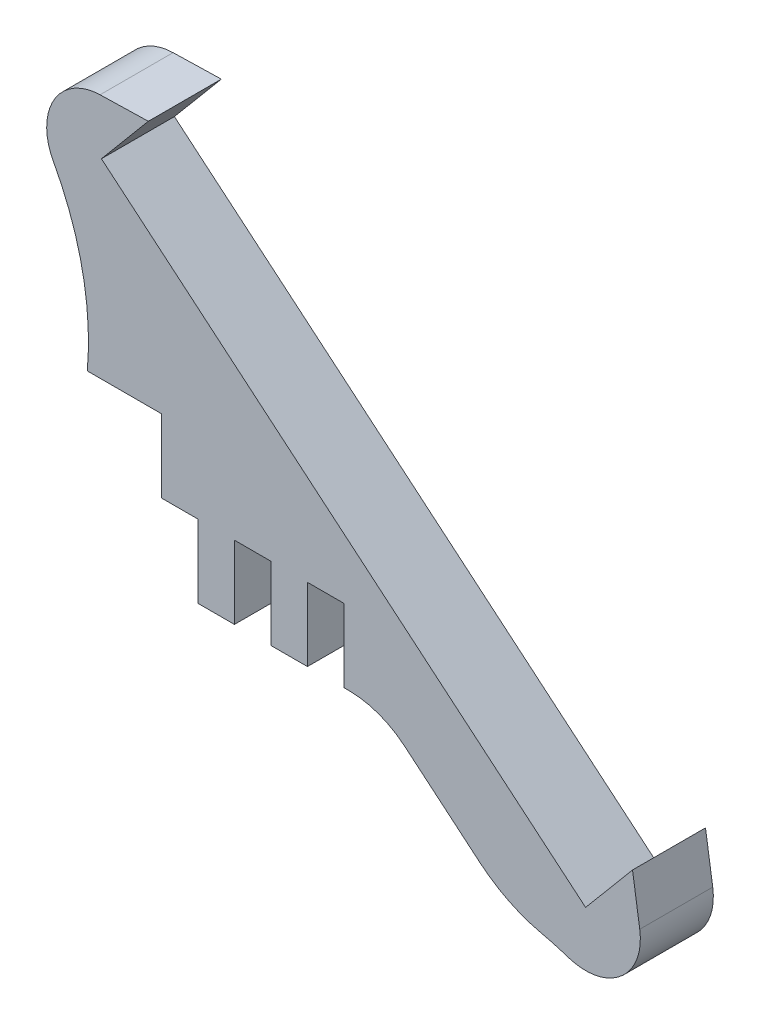
from build123d import *

# Parameters (mm, degrees)
BOSS_EXTRUDE1_DEPTH = 6.35


with BuildPart() as part:
    # Sketch1 → Boss-Extrude1 (new body)
    with BuildSketch(Plane.XY):
        with BuildLine():
            Line((8.142065145, 0), (11.317065145, 0))
            Line((11.317065145, 0), (11.317065145, -6.35))
            Line((11.317065145, -6.35), (14.492065145, -6.35))
            Line((14.492065145, -6.35), (14.492065145, 0))
            Line((14.492065145, 0), (17.667065145, 0))
            Line((17.667065145, 0), (17.667065145, -6.35))
            Line((17.667065145, -6.35), (20.842065145, -6.35))
            Line((20.842065145, -6.35), (20.842065145, 0))
            Line((20.842065145, 0), (24.017065145, 0))
            Line((24.017065145, 0), (24.017065145, -6.35))
            Line((24.017065145, -6.35), (24.41861196, -6.35))
            ThreePointArc((24.41861196, -6.35), (27.024805452, -6.80954223), (29.316653546, -8.132741343))
            Line((29.316653546, -8.132741343), (35.829824373, -13.597940583))
            ThreePointArc((35.829824373, -13.597940583), (38.340167596, -15.241639353), (41.166077246, -16.250501778))
            ThreePointArc((41.166077246, -16.250501778), (42.360633111, -16.553938407), (43.539063258, -16.914964572))
            ThreePointArc((43.539063258, -16.914964572), (48.11077138, -16.040373561), (49.753251097, -11.685182984))
            Line((49.753251097, -11.685182984), (49.125880621, -7.532172023))
            Line((49.125880621, -7.532172023), (45.0441793, -12.396554237))
            Line((45.0441793, -12.396554237), (2.918629328, 22.950979207))
            Line((2.918629328, 22.950979207), (7.00033065, 27.815361421))
            Line((7.00033065, 27.815361421), (2.801471518, 27.712037944))
            ThreePointArc((2.801471518, 27.712037944), (-1.202340319, 25.338240278), (-1.269775543, 20.68411554))
            ThreePointArc((-1.269775543, 20.68411554), (1.266371651, 13.735078219), (1.692730633, 6.35))
            Line((1.692730633, 6.35), (8.142065145, 6.35))
            Line((8.142065145, 6.35), (8.142065145, 0))
        make_face()
    extrude(amount=BOSS_EXTRUDE1_DEPTH)


solid = part.part
